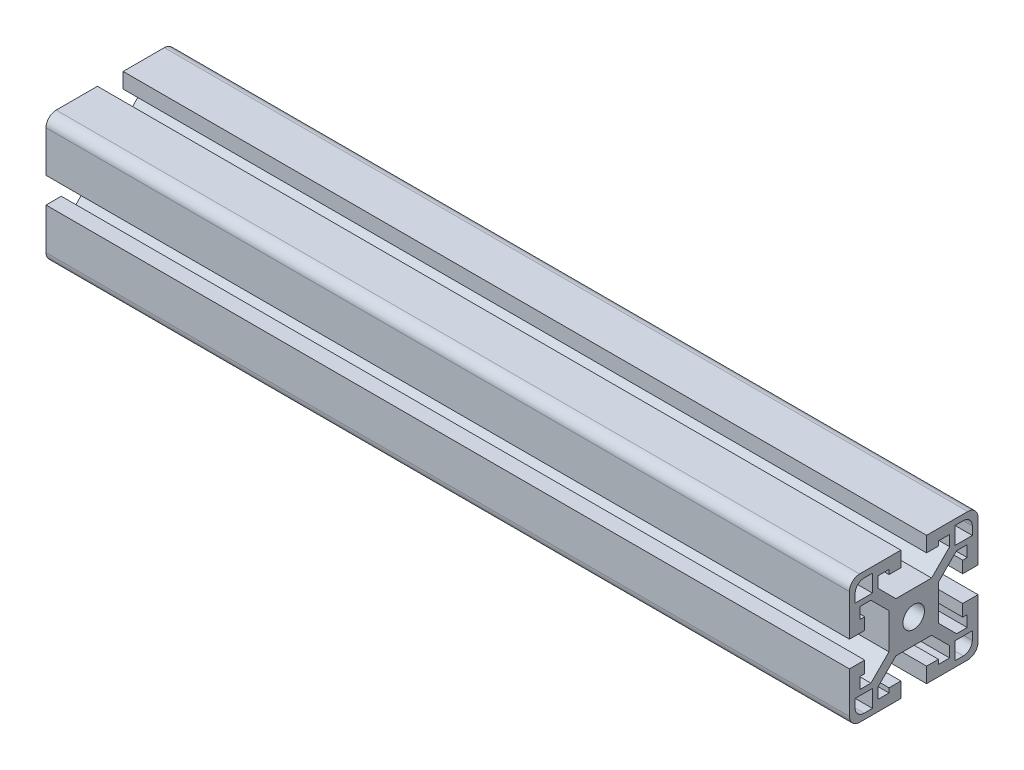
from build123d import *

# Parameters (mm, degrees)
SKETCH2_R                            = 3.35
F_40_SERIES_TS40_40LM_650033_1_DEPTH = 250


with BuildPart() as part:
    # Sketch2 → 40 series TS40-40LM-650033(1) (new body)
    with BuildSketch(Plane(origin=(-125, 0, 0), x_dir=(0, 0, -1), z_dir=(1, 0, 0))):
        with BuildLine():
            Line((-7.7064, 0), (-7.7064, 5.551138531))
            Line((-7.7064, 5.551138531), (-13.331261469, 11.176))
            Line((-13.331261469, 11.176), (-16.6472, 11.176))
            Line((-16.6472, 11.176), (-16.6472, 7.6835))
            Line((-16.6472, 7.6835), (-15.2502, 7.6835))
            Line((-15.2502, 7.6835), (-15.2502, 4.0005))
            Line((-15.2502, 4.0005), (-20, 4.0005))
            Line((-20, 4.0005), (-20, 16.825))
            ThreePointArc((-20, 16.825), (-19.07006403, 19.07006403), (-16.825, 20))
            Line((-16.825, 20), (-4.0005, 20))
            Line((-4.0005, 20), (-4.0005, 15.2502))
            Line((-4.0005, 15.2502), (-7.6835, 15.2502))
            Line((-7.6835, 15.2502), (-7.6835, 16.6472))
            Line((-7.6835, 16.6472), (-11.176, 16.6472))
            Line((-11.176, 16.6472), (-11.176, 13.331261469))
            Line((-11.176, 13.331261469), (-5.551138531, 7.7064))
            Line((-5.551138531, 7.7064), (0, 7.7064))
            Line((0, 7.7064), (5.551138531, 7.7064))
            Line((5.551138531, 7.7064), (11.176, 13.331261469))
            Line((11.176, 13.331261469), (11.176, 16.6472))
            Line((11.176, 16.6472), (7.6835, 16.6472))
            Line((7.6835, 16.6472), (7.6835, 15.2502))
            Line((7.6835, 15.2502), (4.0005, 15.2502))
            Line((4.0005, 15.2502), (4.0005, 20))
            Line((4.0005, 20), (16.825, 20))
            ThreePointArc((16.825, 20), (19.07006403, 19.07006403), (20, 16.825))
            Line((20, 16.825), (20, 4.0005))
            Line((20, 4.0005), (15.2502, 4.0005))
            Line((15.2502, 4.0005), (15.2502, 7.6835))
            Line((15.2502, 7.6835), (16.6472, 7.6835))
            Line((16.6472, 7.6835), (16.6472, 11.176))
            Line((16.6472, 11.176), (13.331261469, 11.176))
            Line((13.331261469, 11.176), (7.7064, 5.551138531))
            Line((7.7064, 5.551138531), (7.7064, 0))
            Line((7.7064, 0), (7.7064, -5.551138531))
            Line((7.7064, -5.551138531), (13.331261469, -11.176))
            Line((13.331261469, -11.176), (16.6472, -11.176))
            Line((16.6472, -11.176), (16.6472, -7.6835))
            Line((16.6472, -7.6835), (15.2502, -7.6835))
            Line((15.2502, -7.6835), (15.2502, -4.0005))
            Line((15.2502, -4.0005), (20, -4.0005))
            Line((20, -4.0005), (20, -16.825))
            ThreePointArc((20, -16.825), (19.07006403, -19.07006403), (16.825, -20))
            Line((16.825, -20), (4.0005, -20))
            Line((4.0005, -20), (4.0005, -15.2502))
            Line((4.0005, -15.2502), (7.6835, -15.2502))
            Line((7.6835, -15.2502), (7.6835, -16.6472))
            Line((7.6835, -16.6472), (11.176, -16.6472))
            Line((11.176, -16.6472), (11.176, -13.331261469))
            Line((11.176, -13.331261469), (5.551138531, -7.7064))
            Line((5.551138531, -7.7064), (0, -7.7064))
            Line((0, -7.7064), (-5.551138531, -7.7064))
            Line((-5.551138531, -7.7064), (-11.176, -13.331261469))
            Line((-11.176, -13.331261469), (-11.176, -16.6472))
            Line((-11.176, -16.6472), (-7.6835, -16.6472))
            Line((-7.6835, -16.6472), (-7.6835, -15.2502))
            Line((-7.6835, -15.2502), (-4.0005, -15.2502))
            Line((-4.0005, -15.2502), (-4.0005, -20))
            Line((-4.0005, -20), (-16.825, -20))
            ThreePointArc((-16.825, -20), (-19.07006403, -19.07006403), (-20, -16.825))
            Line((-20, -16.825), (-20, -4.0005))
            Line((-20, -4.0005), (-15.2502, -4.0005))
            Line((-15.2502, -4.0005), (-15.2502, -7.6835))
            Line((-15.2502, -7.6835), (-16.6472, -7.6835))
            Line((-16.6472, -7.6835), (-16.6472, -11.176))
            Line((-16.6472, -11.176), (-13.331261469, -11.176))
            Line((-13.331261469, -11.176), (-7.7064, -5.551138531))
            Line((-7.7064, -5.551138531), (-7.7064, 0))
        make_face()
        Circle(SKETCH2_R, mode=Mode.SUBTRACT)
        with BuildLine():
            Line((18.222, 12.8372), (18.222, 15.428))
            ThreePointArc((18.222, 15.428), (17.403656347, 17.403656347), (15.428, 18.222))
            Line((15.428, 18.222), (12.8372, 18.222))
            Line((12.8372, 18.222), (12.8372, 12.8372))
            Line((12.8372, 12.8372), (18.222, 12.8372))
        make_face(mode=Mode.SUBTRACT)
        with BuildLine():
            Line((12.8372, -12.8372), (18.222, -12.8372))
            Line((18.222, -12.8372), (18.222, -15.428))
            ThreePointArc((18.222, -15.428), (17.403656347, -17.403656347), (15.428, -18.222))
            Line((15.428, -18.222), (12.8372, -18.222))
            Line((12.8372, -18.222), (12.8372, -12.8372))
        make_face(mode=Mode.SUBTRACT)
        with BuildLine():
            Line((-18.222, -12.8372), (-18.222, -15.428))
            ThreePointArc((-18.222, -15.428), (-17.403656347, -17.403656347), (-15.428, -18.222))
            Line((-15.428, -18.222), (-12.8372, -18.222))
            Line((-12.8372, -18.222), (-12.8372, -12.8372))
            Line((-12.8372, -12.8372), (-18.222, -12.8372))
        make_face(mode=Mode.SUBTRACT)
        with BuildLine():
            Line((-12.8372, 12.8372), (-18.222, 12.8372))
            Line((-18.222, 12.8372), (-18.222, 15.428))
            ThreePointArc((-18.222, 15.428), (-17.403656347, 17.403656347), (-15.428, 18.222))
            Line((-15.428, 18.222), (-12.8372, 18.222))
            Line((-12.8372, 18.222), (-12.8372, 12.8372))
        make_face(mode=Mode.SUBTRACT)
    extrude(amount=F_40_SERIES_TS40_40LM_650033_1_DEPTH)


solid = part.part
